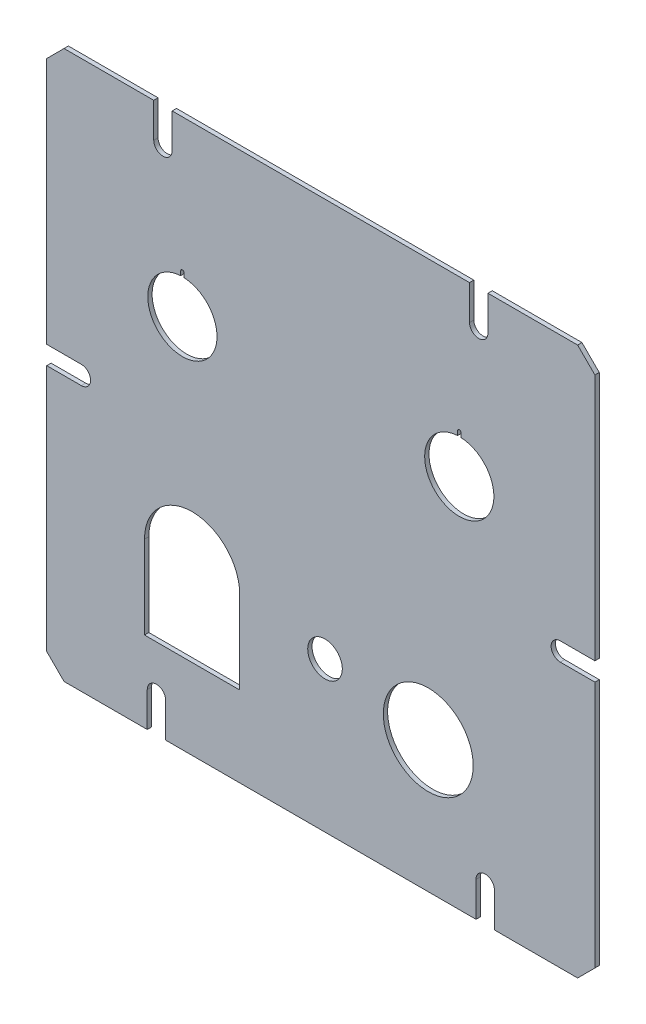
from build123d import *

# Parameters (mm, degrees)
SKETCH1_W                 = 201.168
SKETCH1_H                 = 201.168
BOSS_EXTRUDE1_DEPTH       = 1.5875
CUT_EXTRUDE1_REACH        = 144.256
SKETCH2_R                 = 17.4625
SKETCH2_R_2               = 16.5
F_1_4_CLEARANCE_HOLE1_D   = 6.7564
CHAMFER1_SIZE             = 6.35
CUT_EXTRUDE3_REACH        = 144.256
CUT_EXTRUDE4_REACH        = 144.256
CUT_EXTRUDE5_REACH        = 144.256
SKETCH7_W                 = 6.7564
SKETCH7_H                 = 14.478
SKETCH7_W_2               = 14.478
SKETCH7_H_2               = 6.7564
PORT_FOR_POWER_PLUG_REACH = 144.256
SKETCH8_R                 = 6.35


with BuildPart() as part:
    # Sketch1 → Boss-Extrude1 (new body)
    with BuildSketch(Plane.XY):
        Rectangle(SKETCH1_W, SKETCH1_H)
    extrude(amount=BOSS_EXTRUDE1_DEPTH)

    # Sketch2 → Cut-Extrude1 (cut, up to next)
    with BuildSketch(Plane.XY.offset(1.5875), mode=Mode.PRIVATE) as cut_extrude1_sk1:
        with Locations((-47.244, -40.5765)):
            Circle(SKETCH2_R)
    cut_extrude1_tool1 = extrude(cut_extrude1_sk1.sketch, amount=-CUT_EXTRUDE1_REACH, mode=Mode.PRIVATE) & part.part
    # Sketch2 → Cut-Extrude1 (cut, up to next)
    with BuildSketch(Plane.XY.offset(1.5875), mode=Mode.PRIVATE) as cut_extrude1_sk2:
        with Locations((39.4206, -52.284)):
            Circle(SKETCH2_R_2)
    cut_extrude1_tool2 = extrude(cut_extrude1_sk2.sketch, amount=-CUT_EXTRUDE1_REACH, mode=Mode.PRIVATE) & part.part
    add(cut_extrude1_tool1.solids().sort_by_distance((-47.244, -40.5765, 1.5875))[0], mode=Mode.SUBTRACT)
    add(cut_extrude1_tool2.solids().sort_by_distance((39.4206, -52.284, 1.5875))[0], mode=Mode.SUBTRACT)

    # 1/4 Clearance Hole1 (through all)
    with Locations(Plane.XY.offset(1.5875)):
        with Locations((-57.94375, 87.884), (57.94375, 87.884), (87.884, 0), (-87.884, 0), (-60.325, -87.884), (60.325, -87.884)):
            Hole(F_1_4_CLEARANCE_HOLE1_D / 2)

    # Chamfer1
    chamfer1_edges = [part.edges().sort_by_distance(p)[0] for p in [
        (100.584, -100.584, 0.79375),
        (-100.584, -100.584, 0.79375),
        (-100.584, 100.584, 0.79375),
        (100.584, 100.584, 0.79375),
    ]]
    chamfer(chamfer1_edges, length=CHAMFER1_SIZE)

    # Sketch5 → Cut-Extrude3 (cut, up to next)
    with BuildSketch(Plane(origin=(0, 0, 0), x_dir=(-1, 0, 0), z_dir=(0, 0, -1)), mode=Mode.PRIVATE) as cut_extrude3_sk1:
        with BuildLine():
            Line((29.7815, -40.5765), (29.7815, -71.0565))
            Line((29.7815, -71.0565), (64.7065, -71.0565))
            Line((64.7065, -71.0565), (64.7065, -40.5765))
            ThreePointArc((64.7065, -40.5765), (47.244, -58.039), (29.7815, -40.5765))
        make_face()
    cut_extrude3_tool1 = extrude(cut_extrude3_sk1.sketch, amount=-CUT_EXTRUDE3_REACH, mode=Mode.PRIVATE) & part.part
    add(cut_extrude3_tool1.solids().sort_by_distance((-47.244, -62.220952, 0))[0], mode=Mode.SUBTRACT)

    # Sketch6 → Cut-Extrude4 (cut, up to next)
    with BuildSketch(Plane(origin=(0, 0, 0), x_dir=(-1, 0, 0), z_dir=(0, 0, -1)), mode=Mode.PRIVATE) as cut_extrude4_sk1:
        with BuildLine():
            Line((-50.165, 49.768115066), (-50.165, 51.308))
            ThreePointArc((-50.165, 51.308), (-50.8, 51.943), (-51.435, 51.308))
            Line((-51.435, 51.308), (-51.435, 49.768115066))
            ThreePointArc((-51.435, 49.768115066), (-50.8, 24.384), (-50.165, 49.768115066))
        make_face()
    cut_extrude4_tool1 = extrude(cut_extrude4_sk1.sketch, amount=-CUT_EXTRUDE4_REACH, mode=Mode.PRIVATE) & part.part
    # Sketch6 → Cut-Extrude4 (cut, up to next)
    with BuildSketch(Plane(origin=(0, 0, 0), x_dir=(-1, 0, 0), z_dir=(0, 0, -1)), mode=Mode.PRIVATE) as cut_extrude4_sk2:
        with BuildLine():
            Line((51.435, 49.768115066), (51.435, 51.308))
            ThreePointArc((51.435, 51.308), (50.8, 51.943), (50.165, 51.308))
            Line((50.165, 51.308), (50.165, 49.768115066))
            ThreePointArc((50.165, 49.768115066), (50.8, 24.384), (51.435, 49.768115066))
        make_face()
    cut_extrude4_tool2 = extrude(cut_extrude4_sk2.sketch, amount=-CUT_EXTRUDE4_REACH, mode=Mode.PRIVATE) & part.part
    add(cut_extrude4_tool1.solids().sort_by_distance((50.8, 37.153354, 0))[0], mode=Mode.SUBTRACT)
    add(cut_extrude4_tool2.solids().sort_by_distance((-50.8, 37.153354, 0))[0], mode=Mode.SUBTRACT)

    # Sketch7 → Cut-Extrude5 (cut, up to next)
    with BuildSketch(Plane(origin=(0, 0, 0), x_dir=(-1, 0, 0), z_dir=(0, 0, -1)), mode=Mode.PRIVATE) as cut_extrude5_sk1:
        with Locations((-57.94375, 95.123)):
            Rectangle(SKETCH7_W, SKETCH7_H)
    cut_extrude5_tool1 = extrude(cut_extrude5_sk1.sketch, amount=-CUT_EXTRUDE5_REACH, mode=Mode.PRIVATE) & part.part
    # Sketch7 → Cut-Extrude5 (cut, up to next)
    with BuildSketch(Plane(origin=(0, 0, 0), x_dir=(-1, 0, 0), z_dir=(0, 0, -1)), mode=Mode.PRIVATE) as cut_extrude5_sk2:
        with Locations((57.94375, 95.123)):
            Rectangle(SKETCH7_W, SKETCH7_H)
    cut_extrude5_tool2 = extrude(cut_extrude5_sk2.sketch, amount=-CUT_EXTRUDE5_REACH, mode=Mode.PRIVATE) & part.part
    # Sketch7 → Cut-Extrude5 (cut, up to next)
    with BuildSketch(Plane(origin=(0, 0, 0), x_dir=(-1, 0, 0), z_dir=(0, 0, -1)), mode=Mode.PRIVATE) as cut_extrude5_sk3:
        with Locations((95.123, 0)):
            Rectangle(SKETCH7_W_2, SKETCH7_H_2)
    cut_extrude5_tool3 = extrude(cut_extrude5_sk3.sketch, amount=-CUT_EXTRUDE5_REACH, mode=Mode.PRIVATE) & part.part
    # Sketch7 → Cut-Extrude5 (cut, up to next)
    with BuildSketch(Plane(origin=(0, 0, 0), x_dir=(-1, 0, 0), z_dir=(0, 0, -1)), mode=Mode.PRIVATE) as cut_extrude5_sk4:
        with Locations((60.325, -95.123)):
            Rectangle(SKETCH7_W, SKETCH7_H)
    cut_extrude5_tool4 = extrude(cut_extrude5_sk4.sketch, amount=-CUT_EXTRUDE5_REACH, mode=Mode.PRIVATE) & part.part
    # Sketch7 → Cut-Extrude5 (cut, up to next)
    with BuildSketch(Plane(origin=(0, 0, 0), x_dir=(-1, 0, 0), z_dir=(0, 0, -1)), mode=Mode.PRIVATE) as cut_extrude5_sk5:
        with Locations((-60.325, -95.123)):
            Rectangle(SKETCH7_W, SKETCH7_H)
    cut_extrude5_tool5 = extrude(cut_extrude5_sk5.sketch, amount=-CUT_EXTRUDE5_REACH, mode=Mode.PRIVATE) & part.part
    # Sketch7 → Cut-Extrude5 (cut, up to next)
    with BuildSketch(Plane(origin=(0, 0, 0), x_dir=(-1, 0, 0), z_dir=(0, 0, -1)), mode=Mode.PRIVATE) as cut_extrude5_sk6:
        with Locations((-95.123, 0)):
            Rectangle(SKETCH7_W_2, SKETCH7_H_2)
    cut_extrude5_tool6 = extrude(cut_extrude5_sk6.sketch, amount=-CUT_EXTRUDE5_REACH, mode=Mode.PRIVATE) & part.part
    add(cut_extrude5_tool1.solids().sort_by_distance((57.94375, 95.123, 0))[0], mode=Mode.SUBTRACT)
    add(cut_extrude5_tool2.solids().sort_by_distance((-57.94375, 95.123, 0))[0], mode=Mode.SUBTRACT)
    add(cut_extrude5_tool3.solids().sort_by_distance((-95.123, 0, 0))[0], mode=Mode.SUBTRACT)
    add(cut_extrude5_tool4.solids().sort_by_distance((-60.325, -95.123, 0))[0], mode=Mode.SUBTRACT)
    add(cut_extrude5_tool5.solids().sort_by_distance((60.325, -95.123, 0))[0], mode=Mode.SUBTRACT)
    add(cut_extrude5_tool6.solids().sort_by_distance((95.123, 0, 0))[0], mode=Mode.SUBTRACT)

    # Sketch8 → PORT FOR POWER PLUG (cut, up to next)
    with BuildSketch(Plane(origin=(0, 0, 0), x_dir=(-1, 0, 0), z_dir=(0, 0, -1)), mode=Mode.PRIVATE) as port_for_power_plug_sk1:
        with Locations((-1.533105196, -45.535092969)):
            Circle(SKETCH8_R)
    port_for_power_plug_tool1 = extrude(port_for_power_plug_sk1.sketch, amount=-PORT_FOR_POWER_PLUG_REACH, mode=Mode.PRIVATE) & part.part
    add(port_for_power_plug_tool1.solids().sort_by_distance((1.533105, -45.535093, 0))[0], mode=Mode.SUBTRACT)


solid = part.part
